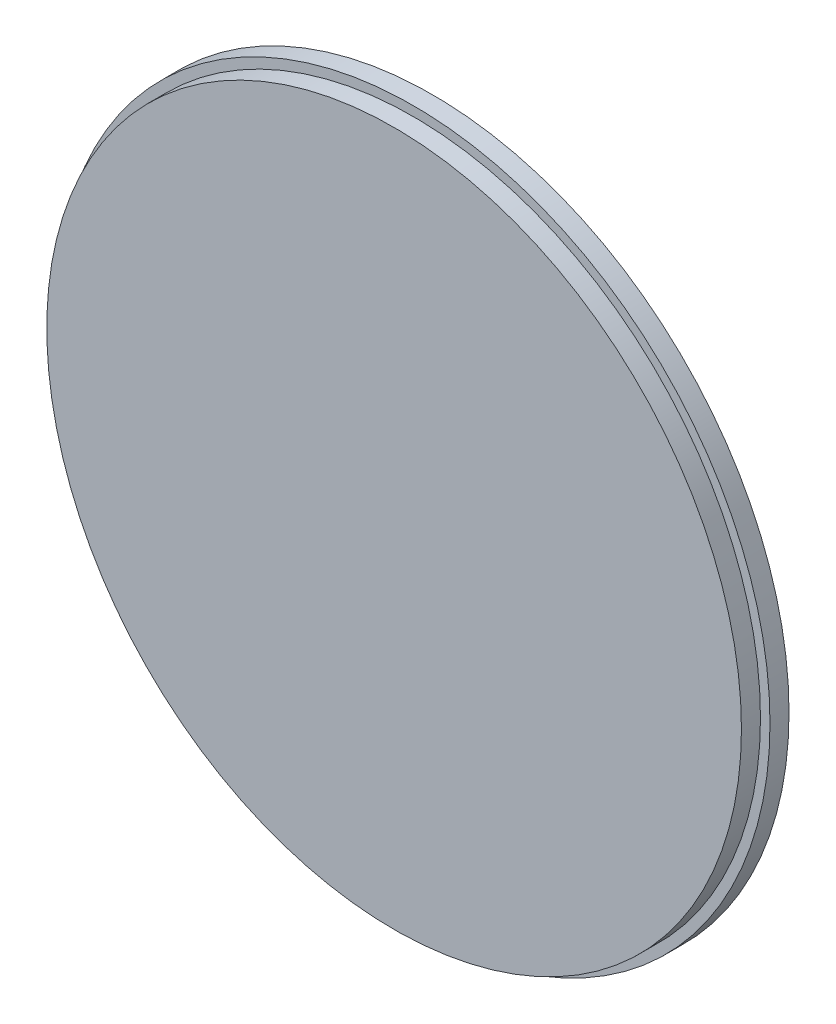
from build123d import *

# Parameters (mm, degrees)
SKETCH1_R           = 18.75
BOSS_EXTRUDE1_DEPTH = 1
SKETCH2_R           = 18.25
BOSS_EXTRUDE2_DEPTH = 1


with BuildPart() as part:
    # Sketch1 → Boss-Extrude1 (new body)
    with BuildSketch(Plane.XY):
        Circle(SKETCH1_R)
    extrude(amount=BOSS_EXTRUDE1_DEPTH)

    # Sketch2 → Boss-Extrude2 (add)
    with BuildSketch(Plane.XY.offset(1)):
        Circle(SKETCH2_R)
    extrude(amount=BOSS_EXTRUDE2_DEPTH)


solid = part.part
